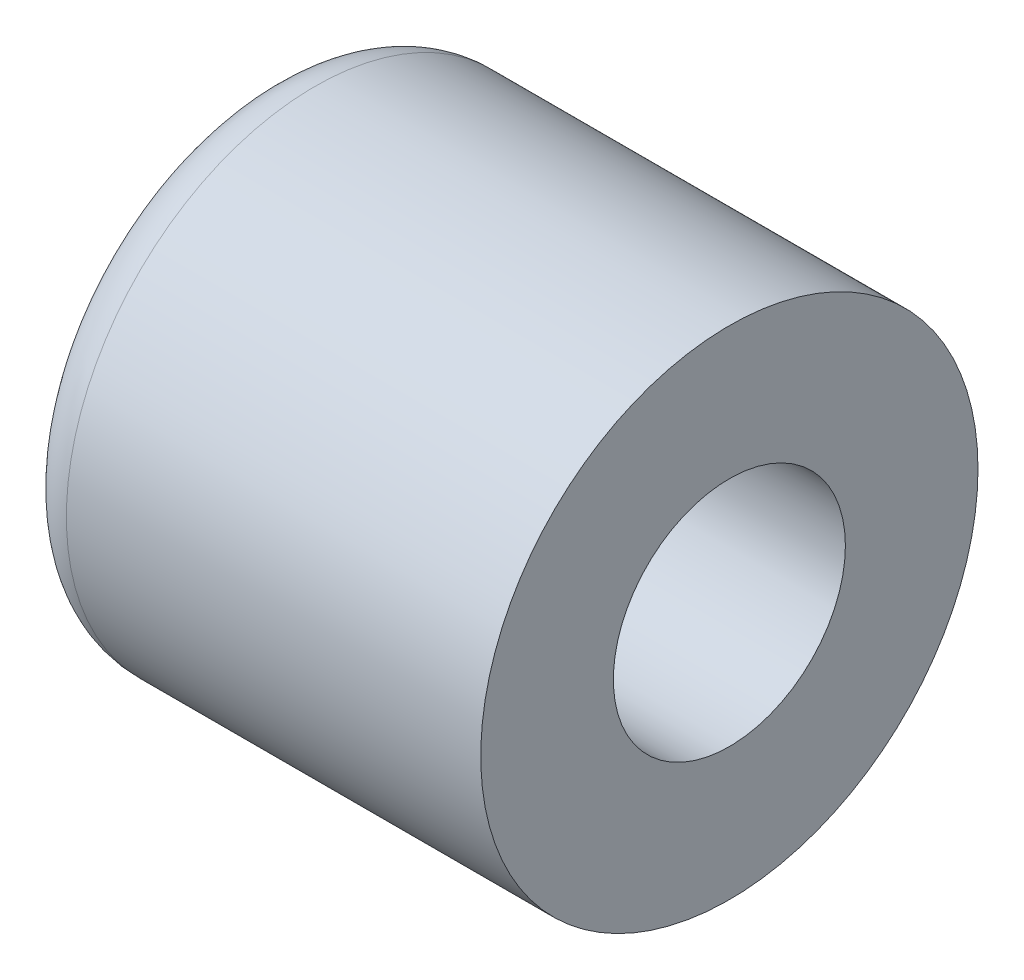
from build123d import *

# Parameters (mm, degrees)
SKETCH1_R                 = 7.5
BOSS_EXTRUDE1_DEPTH       = 7
M8X1_0_TAPPED_HOLE1_D     = 7
M8X1_0_TAPPED_HOLE1_DEPTH = 10
M8X1_0_TAPPED_HOLE1_TIP   = 2.103012167
FILLET1_R                 = 1.5


with BuildPart() as part:
    # Sketch1 → Boss-Extrude1 (new, symmetric)
    with BuildSketch(Plane(origin=(0, 0, 0), x_dir=(0, 0, -1), z_dir=(1, 0, 0))):
        Circle(SKETCH1_R)
    extrude(amount=BOSS_EXTRUDE1_DEPTH, both=True)

    # M8x1.0 Tapped Hole1
    with Locations(Plane(origin=(7, 0, 0), x_dir=(0, 0, -1), z_dir=(1, 0, 0))):
        with Locations((0, 0)):
            Hole(M8X1_0_TAPPED_HOLE1_D / 2, depth=M8X1_0_TAPPED_HOLE1_DEPTH)
            with Locations((0, 0, -(M8X1_0_TAPPED_HOLE1_DEPTH + M8X1_0_TAPPED_HOLE1_TIP / 2))):  # 118° drill point
                Cone(0, M8X1_0_TAPPED_HOLE1_D / 2, M8X1_0_TAPPED_HOLE1_TIP, mode=Mode.SUBTRACT)

    # Fillet1
    fillet1_edges = [part.edges().sort_by_distance(p)[0] for p in [
        (-7, 0, 7.5),
    ]]
    fillet(fillet1_edges, radius=FILLET1_R)


solid = part.part
